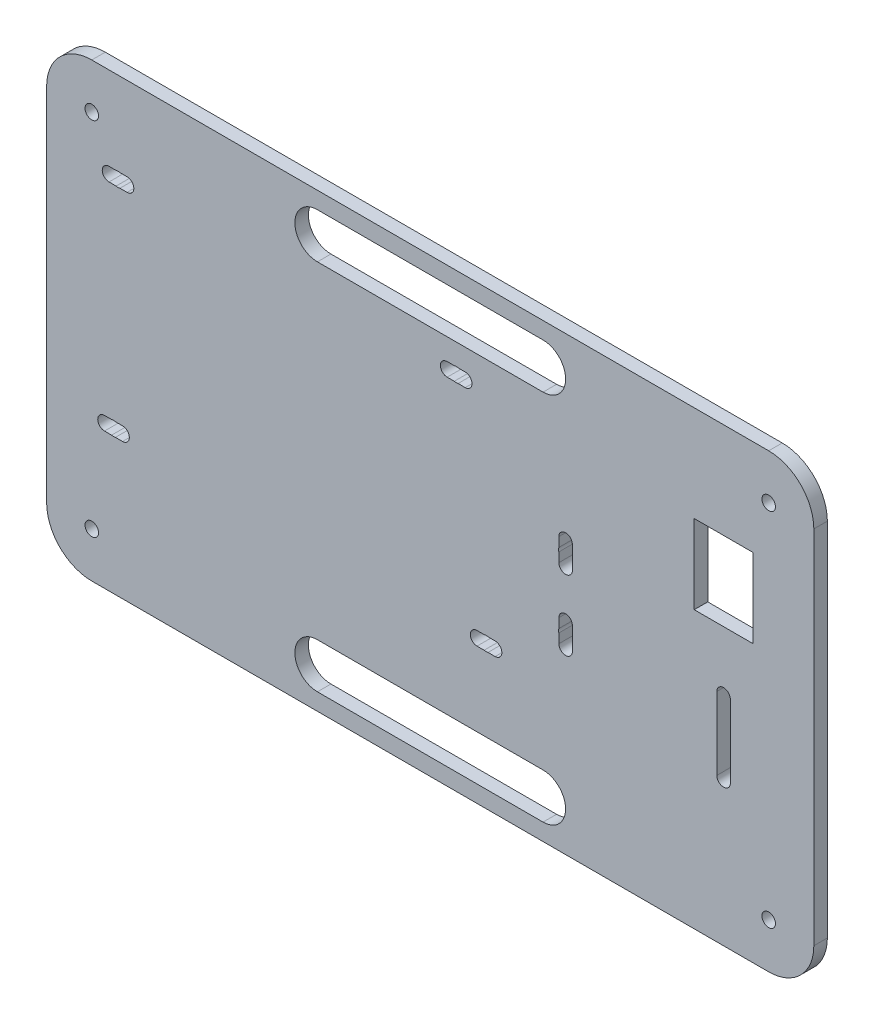
from build123d import *

# Parameters (mm, degrees)
SKETCH1_R           = 1.5
SKETCH1_W           = 13
SKETCH1_H           = 17.5
BOSS_EXTRUDE1_DEPTH = 3


with BuildPart() as part:
    # Sketch1 → Boss-Extrude1 (new body)
    with BuildSketch(Plane.XY):
        with BuildLine():
            Line((75, 50), (-75, 50))
            ThreePointArc((-75, 50), (-82.071067812, 47.071067812), (-85, 40))
            Line((-85, 40), (-85, -40))
            ThreePointArc((-85, -40), (-82.071067812, -47.071067812), (-75, -50))
            Line((-75, -50), (75, -50))
            ThreePointArc((75, -50), (82.071067812, -47.071067812), (85, -40))
            Line((85, -40), (85, 40))
            ThreePointArc((85, 40), (82.071067812, 47.071067812), (75, 50))
        make_face()
        with Locations((-75, -40)):
            Circle(SKETCH1_R, mode=Mode.SUBTRACT)
        with BuildLine():
            ThreePointArc((-72.18, -19.8), (-73.68, -18.3), (-72.18, -16.8))
            Line((-72.18, -16.8), (-70.608485706, -16.8))
            ThreePointArc((-70.608485706, -16.8), (-70.18, -16.74), (-69.751514294, -16.8))
            Line((-69.751514294, -16.8), (-68.18, -16.8))
            ThreePointArc((-68.18, -16.8), (-66.68, -18.3), (-68.18, -19.8))
            Line((-68.18, -19.8), (-69.751514294, -19.8))
            ThreePointArc((-69.751514294, -19.8), (-70.18, -19.86), (-70.608485706, -19.8))
            Line((-70.608485706, -19.8), (-72.18, -19.8))
        make_face(mode=Mode.SUBTRACT)
        with BuildLine():
            Line((25, -46.257829906), (-25, -46.257829906))
            ThreePointArc((-25, -46.257829906), (-30, -41.257829906), (-25, -36.257829906))
            Line((-25, -36.257829906), (25, -36.257829906))
            ThreePointArc((25, -36.257829906), (30, -41.257829906), (25, -46.257829906))
        make_face(mode=Mode.SUBTRACT)
        with Locations((75, -40)):
            Circle(SKETCH1_R, mode=Mode.SUBTRACT)
        with BuildLine():
            ThreePointArc((10.37, -19.8), (8.87, -18.3), (10.37, -16.8))
            Line((10.37, -16.8), (11.941514294, -16.8))
            ThreePointArc((11.941514294, -16.8), (12.37, -16.74), (12.798485706, -16.8))
            Line((12.798485706, -16.8), (14.37, -16.8))
            ThreePointArc((14.37, -16.8), (15.87, -18.3), (14.37, -19.8))
            Line((14.37, -19.8), (12.798485706, -19.8))
            ThreePointArc((12.798485706, -19.8), (12.37, -19.86), (11.941514294, -19.8))
            Line((11.941514294, -19.8), (10.37, -19.8))
        make_face(mode=Mode.SUBTRACT)
        with BuildLine():
            Line((28.5, -7.351514294), (28.5, -5.28))
            ThreePointArc((28.5, -5.28), (30, -3.78), (31.5, -5.28))
            Line((31.5, -5.28), (31.5, -7.351514294))
            ThreePointArc((31.5, -7.351514294), (31.544927183, -7.563666923), (31.56, -7.78))
            ThreePointArc((31.56, -7.78), (31.544927183, -7.996333077), (31.5, -8.208485706))
            Line((31.5, -8.208485706), (31.5, -10.28))
            ThreePointArc((31.5, -10.28), (30, -11.78), (28.5, -10.28))
            Line((28.5, -10.28), (28.5, -8.208485706))
            ThreePointArc((28.5, -8.208485706), (28.44, -7.78), (28.5, -7.351514294))
        make_face(mode=Mode.SUBTRACT)
        with BuildLine():
            ThreePointArc((63.5, -1.95), (65, -0.45), (66.5, -1.95))
            Line((66.5, -1.95), (66.5, -18.05))
            ThreePointArc((66.5, -18.05), (65, -19.55), (63.5, -18.05))
            Line((63.5, -18.05), (63.5, -1.95))
        make_face(mode=Mode.SUBTRACT)
        with BuildLine():
            ThreePointArc((-67.18, 31.5), (-65.68, 30), (-67.18, 28.5))
            Line((-67.18, 28.5), (-68.751514294, 28.5))
            ThreePointArc((-68.751514294, 28.5), (-69.18, 28.44), (-69.608485706, 28.5))
            Line((-69.608485706, 28.5), (-71.18, 28.5))
            ThreePointArc((-71.18, 28.5), (-72.68, 30), (-71.18, 31.5))
            Line((-71.18, 31.5), (-69.608485706, 31.5))
            ThreePointArc((-69.608485706, 31.5), (-69.18, 31.56), (-68.751514294, 31.5))
            Line((-68.751514294, 31.5), (-67.18, 31.5))
        make_face(mode=Mode.SUBTRACT)
        with Locations((-75, 40)):
            Circle(SKETCH1_R, mode=Mode.SUBTRACT)
        with BuildLine():
            ThreePointArc((31.5, 5.28), (30, 3.78), (28.5, 5.28))
            Line((28.5, 5.28), (28.5, 7.351514294))
            ThreePointArc((28.5, 7.351514294), (28.44, 7.78), (28.5, 8.208485706))
            Line((28.5, 8.208485706), (28.5, 10.28))
            ThreePointArc((28.5, 10.28), (30, 11.78), (31.5, 10.28))
            Line((31.5, 10.28), (31.5, 8.208485706))
            ThreePointArc((31.5, 8.208485706), (31.544927183, 7.996333077), (31.56, 7.78))
            ThreePointArc((31.56, 7.78), (31.544927183, 7.563666923), (31.5, 7.351514294))
            Line((31.5, 7.351514294), (31.5, 5.28))
        make_face(mode=Mode.SUBTRACT)
        with Locations((65, 20)):
            Rectangle(SKETCH1_W, SKETCH1_H, mode=Mode.SUBTRACT)
        with BuildLine():
            ThreePointArc((3.75, 28.5), (2.25, 30), (3.75, 31.5))
            Line((3.75, 31.5), (5.321514294, 31.5))
            ThreePointArc((5.321514294, 31.5), (5.75, 31.56), (6.178485706, 31.5))
            Line((6.178485706, 31.5), (7.75, 31.5))
            ThreePointArc((7.75, 31.5), (9.25, 30), (7.75, 28.5))
            Line((7.75, 28.5), (6.178485706, 28.5))
            ThreePointArc((6.178485706, 28.5), (5.75, 28.44), (5.321514294, 28.5))
            Line((5.321514294, 28.5), (3.75, 28.5))
        make_face(mode=Mode.SUBTRACT)
        with BuildLine():
            ThreePointArc((-25, 36.257829906), (-30, 41.257829906), (-25, 46.257829906))
            Line((-25, 46.257829906), (25, 46.257829906))
            ThreePointArc((25, 46.257829906), (30, 41.257829906), (25, 36.257829906))
            Line((25, 36.257829906), (-25, 36.257829906))
        make_face(mode=Mode.SUBTRACT)
        with Locations((75, 40)):
            Circle(SKETCH1_R, mode=Mode.SUBTRACT)
    extrude(amount=BOSS_EXTRUDE1_DEPTH)


solid = part.part
